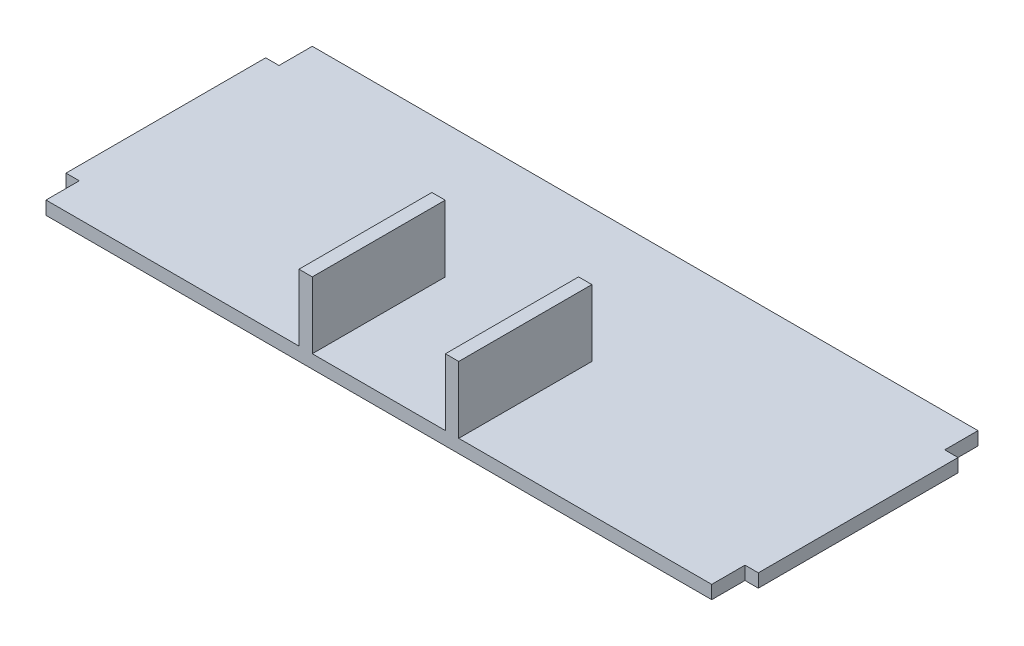
from build123d import *

# Parameters (mm, degrees)
SKETCH_1_W      = 2
SKETCH_1_H      = 30
EXTRUDE_3_DEPTH = 2
SKETCH_3_W      = 2
SKETCH_3_H      = 19.963569182
SKETCH_3_H_2    = 20
EXTRUDE_4_DEPTH = 12


with BuildPart() as part:
    # 草图1 → 凸台-拉伸3 (new body)
    with BuildSketch(Plane(origin=(0, 0, 0), x_dir=(1, 0, 0), z_dir=(0, 1, 0))):
        Polygon((100, 40), (0, 40), (0, 35), (0, 5), (0, 0), (38, 0), (38, 20), (40, 20), (40, 0), (60, 0), (60, 20), (62, 20), (62, 0), (100, 0), (100, 5), (100, 35), align=None)
        with Locations((-1, 20)):
            Rectangle(SKETCH_1_W, SKETCH_1_H)
        with Locations((101, 20)):
            Rectangle(SKETCH_1_W, SKETCH_1_H)
    extrude(amount=EXTRUDE_3_DEPTH)

    # 草图3 → 凸台-拉伸4 (add)
    with BuildSketch(Plane(origin=(0, 0, 0), x_dir=(1, 0, 0), z_dir=(0, 1, 0))):
        with Locations((39, 9.981784591)):
            Rectangle(SKETCH_3_W, SKETCH_3_H)
        with Locations((61, 10)):
            Rectangle(SKETCH_3_W, SKETCH_3_H_2)
    extrude(amount=EXTRUDE_4_DEPTH)


solid = part.part
